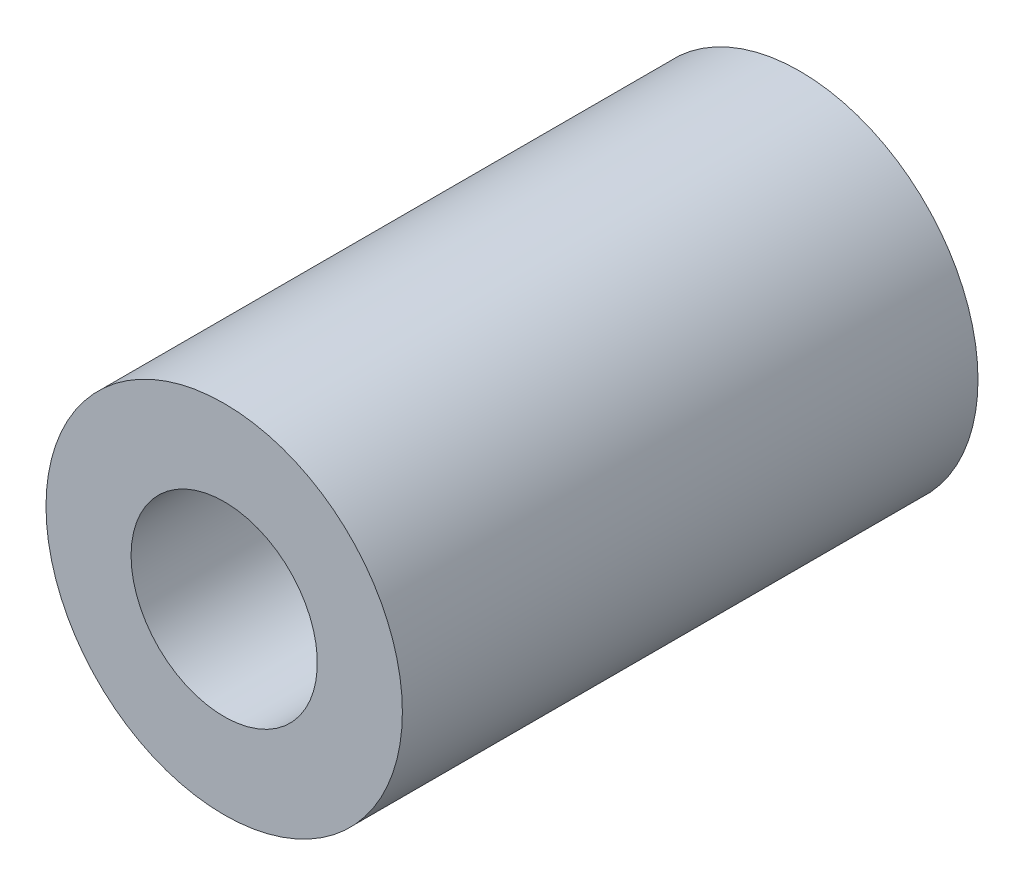
from build123d import *

# Parameters (mm, degrees)
SKETCH1_R           = 4.7625
SKETCH1_R_2         = 2.4892
BOSS_EXTRUDE1_DEPTH = 7.69239


with BuildPart() as part:
    # Sketch1 → Boss-Extrude1 (new, symmetric)
    with BuildSketch(Plane.XY):
        with Locations(Location((0, 0, 0), (0, 0, 180))):
            Circle(SKETCH1_R)
        with Locations(Location((0, 0, 0), (0, 0, 180))):
            Circle(SKETCH1_R_2, mode=Mode.SUBTRACT)
    extrude(amount=BOSS_EXTRUDE1_DEPTH, both=True)


solid = part.part
